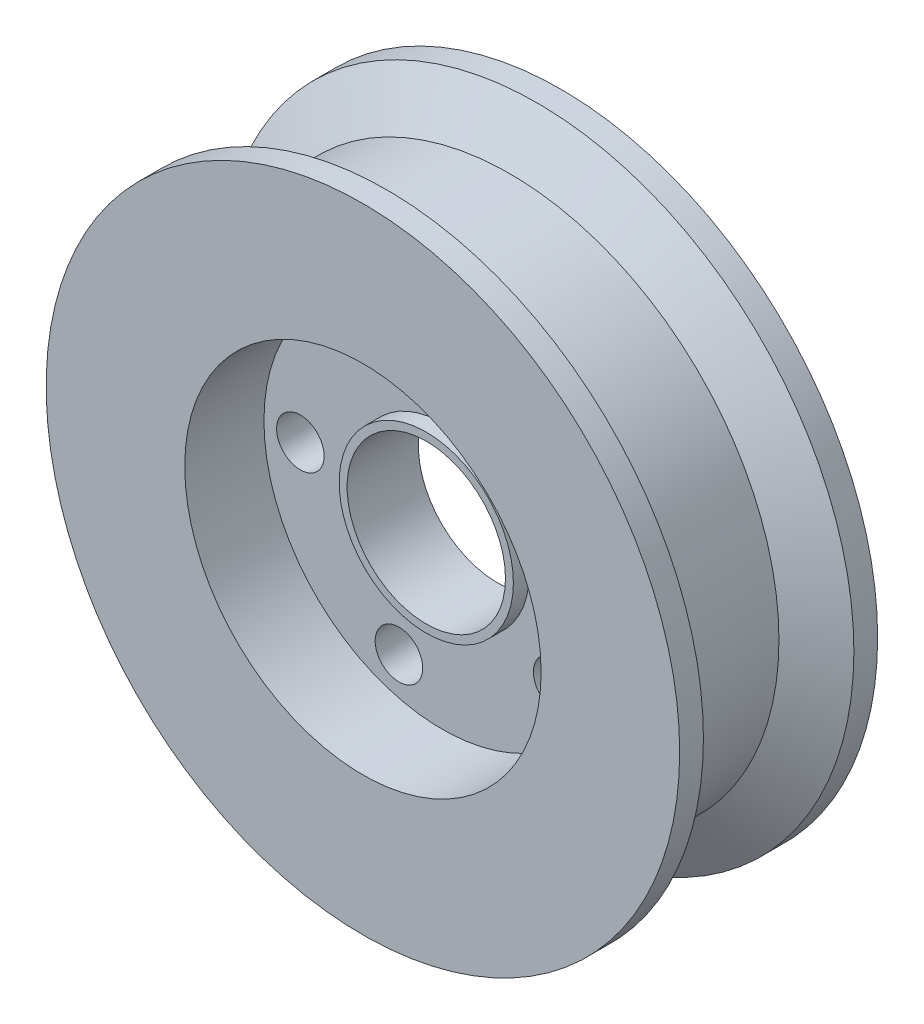
from build123d import *

# Parameters (mm, degrees)
SKETCH1_R                = 40
SKETCH1_R_2              = 10
BOSS_EXTRUDE1_DEPTH      = 12.5
SKETCH2_R                = 22.5
CUT_EXTRUDE1_DEPTH       = 10
SKETCH3_R                = 3
CUT_EXTRUDE2_DEPTH       = 59.523499554
CIRPATTERN1_COUNT        = 5
BOSS_EXTRUDE2_DEPTH      = 2
BOSS_EXTRUDE2_DEPTH_BACK = 7
SKETCH4_R                = 11
SKETCH4_R_2              = 10


with BuildPart() as part:
    # Sketch1 → Boss-Extrude1 (new, symmetric)
    with BuildSketch(Plane.XY):
        Circle(SKETCH1_R)
        Circle(SKETCH1_R_2, mode=Mode.SUBTRACT)
    extrude(amount=BOSS_EXTRUDE1_DEPTH, both=True)

    # Sketch2 → Cut-Extrude1 (cut)
    with BuildSketch(Plane.XY.offset(12.5)):
        Circle(SKETCH2_R)
    cut_extrude1 = extrude(amount=-CUT_EXTRUDE1_DEPTH, mode=Mode.SUBTRACT)

    # Mirror1: Cut-Extrude1 across plane
    add(cut_extrude1.mirror(Plane.XY), mode=Mode.SUBTRACT)

    # Sketch3 → Cut-Extrude2 (cut, through all)
    with BuildSketch(Plane.XY.offset(2.5)):
        with Locations((-5.610749144, 17)):
            Circle(SKETCH3_R)
    cut_extrude2 = extrude(amount=-CUT_EXTRUDE2_DEPTH, mode=Mode.SUBTRACT)

    # CirPattern1: Cut-Extrude2 ×5 about axis
    cirpattern1_axis = Axis((0, 0, 0), (0, 0, 1))
    for i in range(1, CIRPATTERN1_COUNT):
        add(cut_extrude2.rotate(cirpattern1_axis, i * 360 / CIRPATTERN1_COUNT), mode=Mode.SUBTRACT)

    # Sketch4 → Boss-Extrude2 (add, two sides: drawn at the far end of the back side and taken through both)
    with BuildSketch(Plane.XY.offset(2.5).offset(-BOSS_EXTRUDE2_DEPTH_BACK)):
        Circle(SKETCH4_R)
        Circle(SKETCH4_R_2, mode=Mode.SUBTRACT)
    extrude(amount=BOSS_EXTRUDE2_DEPTH + BOSS_EXTRUDE2_DEPTH_BACK)

    # Sketch5 → Cut-Revolve1 (revolve, cut)
    with BuildSketch(Plane(origin=(0, 0, 0), x_dir=(1, 0, 0), z_dir=(0, 1, 0)), mode=Mode.PRIVATE) as cut_revolve1_sk:
        Polygon((-40, -9.5), (-34, -6.035898385), (-34, 6.035898385), (-40, 9.5), align=None)
    revolve(cut_revolve1_sk.sketch.rotate(Axis((0, 0, 0), (0, 0, -1)), 180), axis=Axis((0, 0, 0), (0, 0, -1)), mode=Mode.SUBTRACT)


solid = part.part
